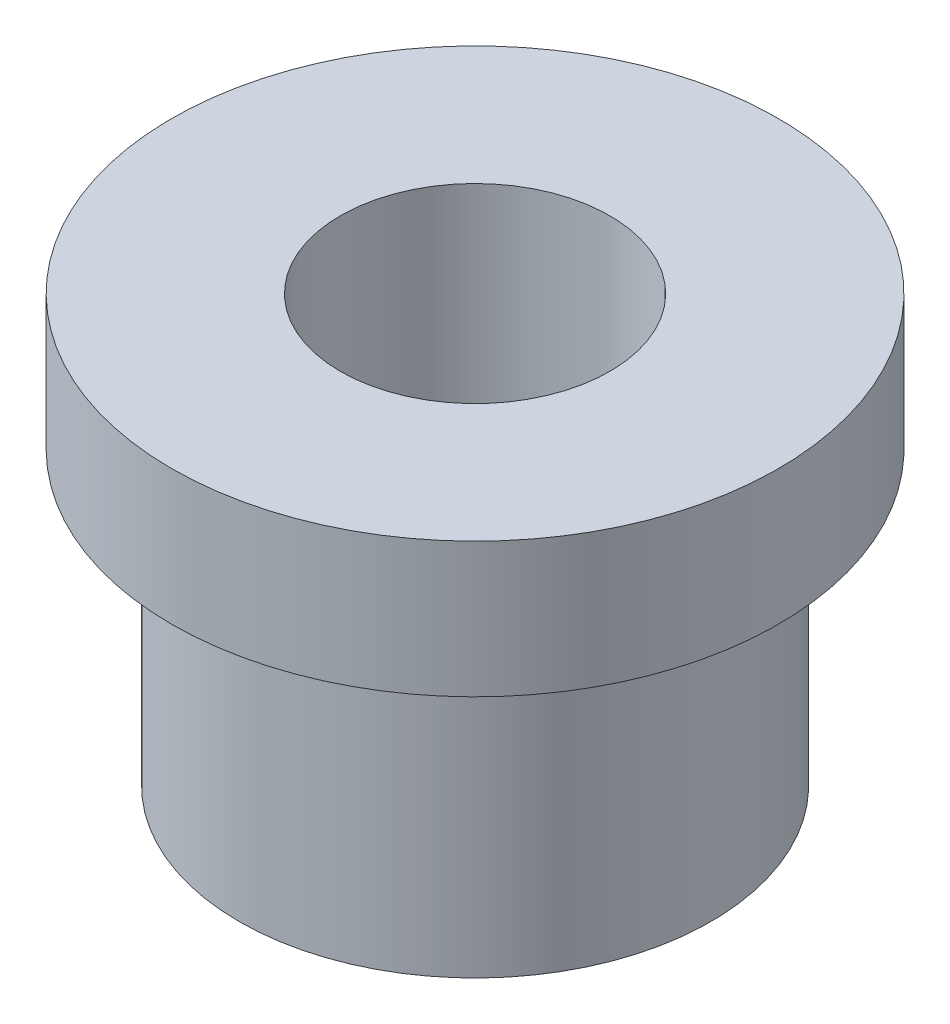
from build123d import *

# Parameters (mm, degrees)
SKETCH1_R           = 11.1125
SKETCH1_R_2         = 6.35
BOSS_EXTRUDE1_DEPTH = 13.716
SKETCH2_R           = 14.2875
SKETCH2_R_2         = 6.35
BOSS_EXTRUDE2_DEPTH = 6.35


with BuildPart() as part:
    # Sketch1 → Boss-Extrude1 (new body)
    with BuildSketch(Plane(origin=(0, 0, 0), x_dir=(1, 0, 0), z_dir=(0, 1, 0))):
        with Locations(Location((0, 0, 0), (0, 0, 270))):
            Circle(SKETCH1_R)
        with Locations(Location((0, 0, 0), (0, 0, 270))):
            Circle(SKETCH1_R_2, mode=Mode.SUBTRACT)
    extrude(amount=BOSS_EXTRUDE1_DEPTH)

    # Sketch2 → Boss-Extrude2 (add)
    with BuildSketch(Plane(origin=(0, 13.716, 0), x_dir=(1, 0, 0), z_dir=(0, 1, 0))):
        with Locations(Location((0, 0, 0), (0, 0, 270))):
            Circle(SKETCH2_R)
        with Locations(Location((0, 0, 0), (0, 0, 270))):
            Circle(SKETCH2_R_2, mode=Mode.SUBTRACT)
    extrude(amount=BOSS_EXTRUDE2_DEPTH)


solid = part.part
